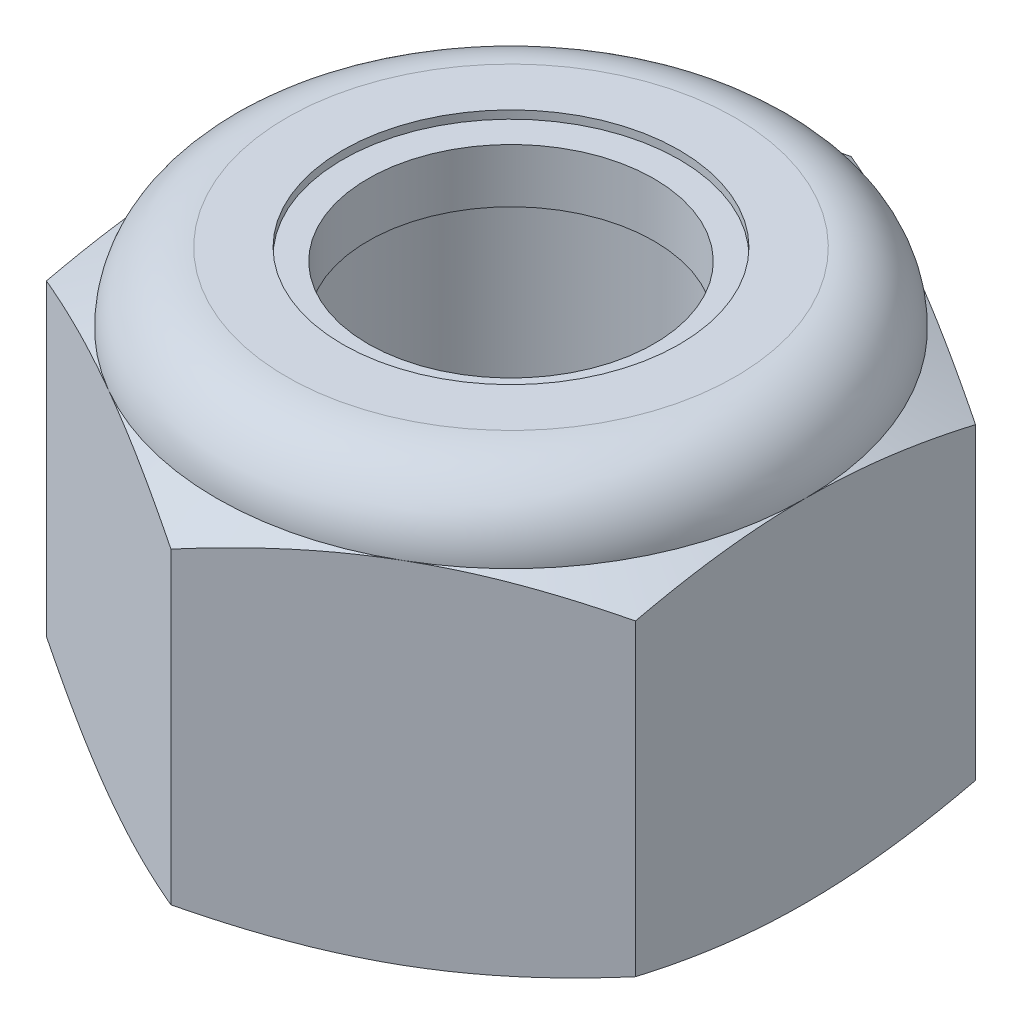
from build123d import *

# Parameters (mm, degrees)
SKETCH1_R      = 3.175
EXTRUDE1_DEPTH = 7.9375


with BuildPart() as part:
    # Sketch1 → Extrude1 (new body)
    with BuildSketch(Plane(origin=(0, 0, 0), x_dir=(1, 0, 0), z_dir=(0, 1, 0))):
        Polygon((0, 6.415804866), (-5.55625, 3.207902433), (-5.55625, -3.207902433), (0, -6.415804866), (5.55625, -3.207902433), (5.55625, 3.207902433), align=None)
        with Locations(Location((0, 0, 0), (0, 0, 270))):
            Circle(SKETCH1_R, mode=Mode.SUBTRACT)
    extrude(amount=EXTRUDE1_DEPTH)

    # Sketch5 → Cut-Revolve3 (revolve, cut)
    with BuildSketch(Plane(origin=(0, 0, 0), x_dir=(0, 0, -1), z_dir=(1, 0, 0))):
        with BuildLine():
            Line((0, 0), (5.55625, 0))
            Line((5.55625, 0), (6.415804866, 0.400817017))
            Line((6.415804866, 0.400817017), (6.415804866, 6.213766317))
            Line((6.415804866, 6.213766317), (5.55625, 6.614583333))
            ThreePointArc((5.55625, 6.614583333), (5.168776679, 7.550026679), (4.233333333, 7.9375))
            Line((4.233333333, 7.9375), (4.233333333, 9.2075))
            Line((4.233333333, 9.2075), (7.685804866, 9.2075))
            Line((7.685804866, 9.2075), (7.685804866, -1.27))
            Line((7.685804866, -1.27), (0, -1.27))
            Line((0, -1.27), (0, 0))
        make_face()
    revolve(axis=Axis((0, 0, 0), (0, 1, 0)), mode=Mode.SUBTRACT)

    # Sketch6 → Cut-Revolve4 (revolve, cut)
    with BuildSketch(Plane(origin=(0, 0, 0), x_dir=(0, 0, -1), z_dir=(1, 0, 0)), mode=Mode.PRIVATE) as cut_revolve4_sk:
        with BuildLine():
            Line((0, 6.614583333), (5.40385, 6.614583333))
            ThreePointArc((5.40385, 6.614583333), (5.061013606, 7.442263606), (4.233333333, 7.7851))
            Line((4.233333333, 7.7851), (2.116666667, 7.7851))
            Line((2.116666667, 7.7851), (2.116666667, 9.2075))
            Line((2.116666667, 9.2075), (0, 9.2075))
            Line((0, 9.2075), (0, 6.614583333))
        make_face()
    revolve(cut_revolve4_sk.sketch.rotate(Axis((0, 9.2075, 0), (0, -1, 0)), 180), axis=Axis((0, 9.2075, 0), (0, -1, 0)), mode=Mode.SUBTRACT)

    # Sketch4 → Cut-Revolve2 (revolve, cut)
    with BuildSketch(Plane(origin=(0, 0, 0), x_dir=(0, 0, -1), z_dir=(1, 0, 0))):
        Polygon((0, 6.614583333), (3.4925, 6.614583333), (0, 4.986003837), align=None)
        Polygon((0, 1.628579496), (3.4925, 0), (0, 0), align=None)
    revolve(axis=Axis((0, 0, 0), (0, 1, 0)), mode=Mode.SUBTRACT)


with BuildPart() as body_2:
    # Sketch7 → Revolve2 (revolve)
    with BuildSketch(Plane(origin=(0, 0, 0), x_dir=(0, 0, -1), z_dir=(1, 0, 0))):
        with BuildLine():
            Line((2.69875, 6.690783333), (5.324993778, 6.690783333))
            ThreePointArc((5.324993778, 6.690783333), (4.979705237, 7.4148695), (4.233333333, 7.7089))
            Line((4.233333333, 7.7089), (2.69875, 7.7089))
            Line((2.69875, 7.7089), (2.69875, 6.690783333))
        make_face()
    revolve(axis=Axis((0, 6.690783333, 0), (0, 1, 0)))


solid = Compound([part.part, body_2.part])
